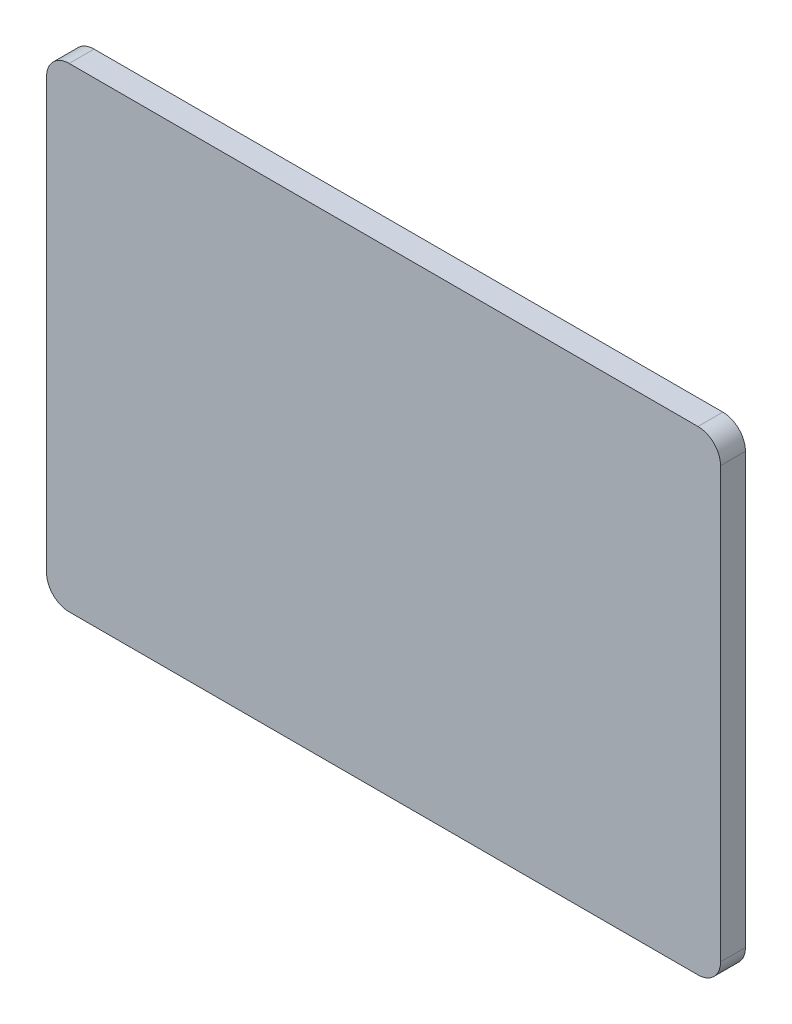
from build123d import *

# Parameters (mm, degrees)
ESQUISSE1_W        = 298
ESQUISSE1_H        = 210
BOSS_EXTRU_1_DEPTH = 11
CONG_1_R           = 10


with BuildPart() as part:
    # Esquisse1 → Boss.-Extru.1 (new body)
    with BuildSketch(Plane.XY):
        with Locations((149, 105)):
            Rectangle(ESQUISSE1_W, ESQUISSE1_H)
    extrude(amount=BOSS_EXTRU_1_DEPTH)

    # Congé1
    cong_1_edges = [part.edges().sort_by_distance(p)[0] for p in [
        (0, 210, 5.5),
        (298, 210, 5.5),
        (298, 0, 5.5),
        (0, 0, 5.5),
    ]]
    fillet(cong_1_edges, radius=CONG_1_R)


solid = part.part
